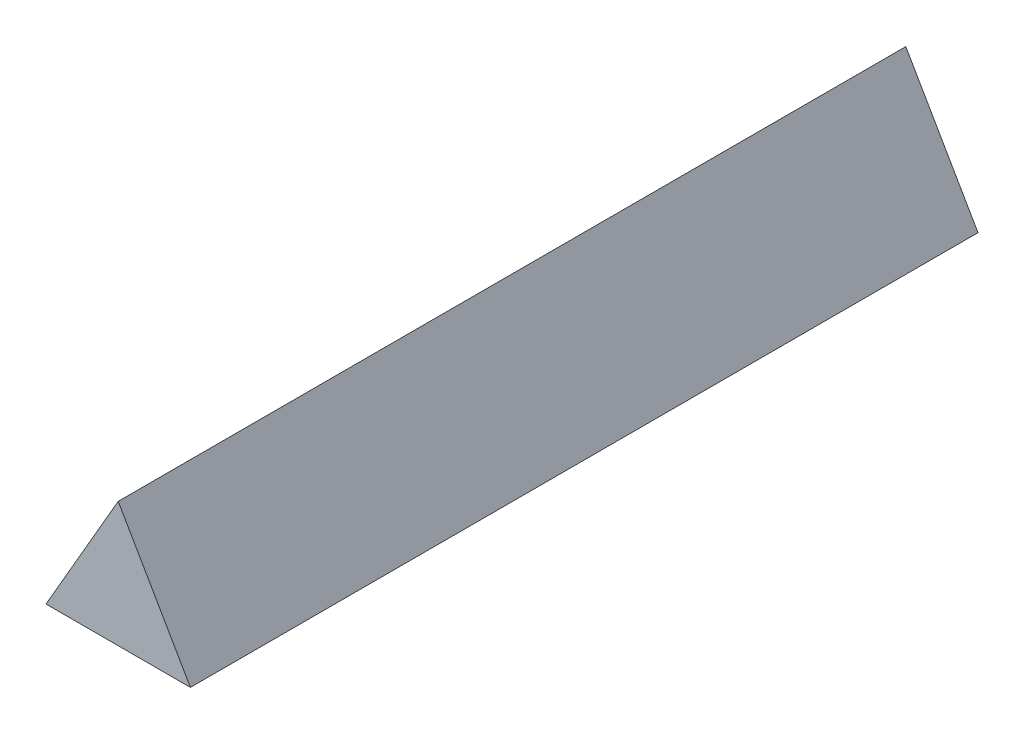
from build123d import *

# Parameters (mm, degrees)
BOSS_EXTRUDE1_DEPTH = 45.72
SKETCH3_R           = 2
CUT_EXTRUDE1_DEPTH  = 8
SKETCH4_R           = 1.27
CUT_EXTRUDE2_DEPTH  = 2.54


with BuildPart() as part:
    # Sketch1 → Boss-Extrude1 (new body)
    with BuildSketch(Plane.XY):
        Polygon((-132.98483419, 115.353503619), (-137.17583419, 108.094478684), (-128.79383419, 108.094478684), align=None)
    extrude(amount=BOSS_EXTRUDE1_DEPTH)

    # Sketch3 → Cut-Extrude1 (cut)
    with BuildSketch(Plane(origin=(0, 0, 0), x_dir=(-1, 0, 0), z_dir=(0, 0, -1))):
        with Locations((132.98483419, 110.514153662)):
            Circle(SKETCH3_R)
    extrude(amount=-CUT_EXTRUDE1_DEPTH, mode=Mode.SUBTRACT)

    # Sketch4 → Cut-Extrude2 (cut)
    with BuildSketch(Plane(origin=(-149.688157917, 86.422498268, 0), x_dir=(0, 0, 1), z_dir=(-0.8660254037844388, 0.4999999999999997, 0))):
        with Locations(Location((4, 29.215647454, 0), (0, 0, 270))):
            Circle(SKETCH4_R)
    extrude(amount=-CUT_EXTRUDE2_DEPTH, mode=Mode.SUBTRACT)


solid = part.part
